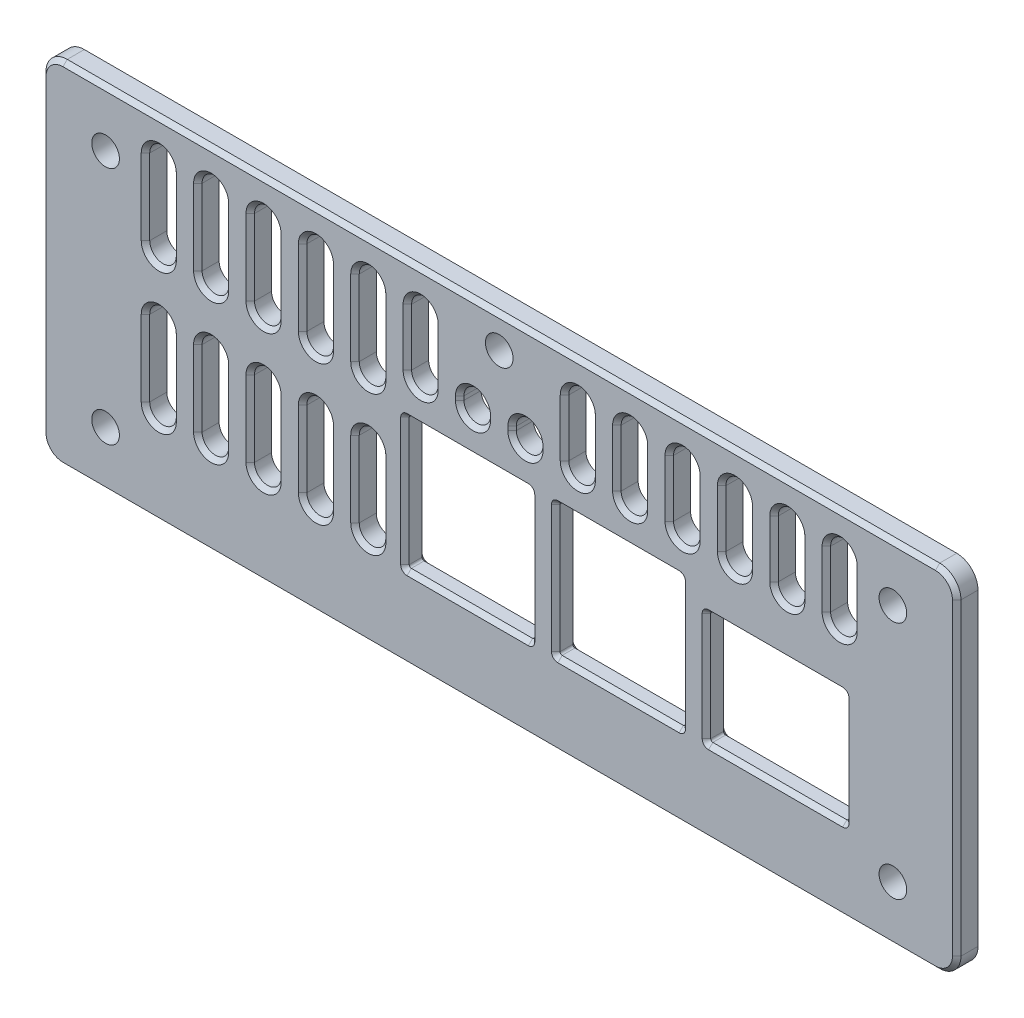
from build123d import *

# Parameters (mm, degrees)
SKETCH1_W               = 109.22
SKETCH1_H               = 41.91
BOSS_EXTRUDE1_DEPTH     = 2.54
CUT_EXTRUDE2_DEPTH      = 59.547550974
CUT_EXTRUDE2_DEPTH_BACK = 59.547550974
SKETCH4_R               = 1.651
FILLET1_R               = 2.54
SKETCH3_W               = 14.986
SKETCH3_H               = 15.748
SKETCH3_W_2             = 16.51
SKETCH3_H_2             = 13.462
RPI_4_CUTOUT_DEPTH      = 59.547550974
SKETCH14_R              = 1.651
CUT_EXTRUDE8_DEPTH      = 59.547550974
CUT_EXTRUDE9_DEPTH      = 59.547550974
CUT_EXTRUDE15_DEPTH     = 59.547550974
FILLET3_R               = 0.254
CHAMFER2_SIZE           = 0.508
CHAMFER3_SIZE           = 0.508


with BuildPart() as part:
    # Sketch1 → Boss-Extrude1 (new body)
    with BuildSketch(Plane.XY):
        Rectangle(SKETCH1_W, SKETCH1_H)
    extrude(amount=BOSS_EXTRUDE1_DEPTH)

    # Sketch4 → Cut-Extrude2 (cut, two sides: drawn at the far end of the back side and taken through both)
    with BuildSketch(Plane.XY.offset(2.54).offset(-CUT_EXTRUDE2_DEPTH_BACK)):
        with Locations((-46.99, 14.2875)):
            Circle(SKETCH4_R)
        with Locations((-46.99, -14.2875)):
            Circle(SKETCH4_R)
        with Locations((46.99, -14.2875)):
            Circle(SKETCH4_R)
        with Locations((46.99, 14.2875)):
            Circle(SKETCH4_R)
    extrude(amount=CUT_EXTRUDE2_DEPTH + CUT_EXTRUDE2_DEPTH_BACK, mode=Mode.SUBTRACT)

    # Fillet1
    fillet1_edges = [part.edges().sort_by_distance(p)[0] for p in [
        (-54.61, 20.955, 1.27),
        (54.61, 20.955, 1.27),
        (54.61, -20.955, 1.27),
        (-54.61, -20.955, 1.27),
    ]]
    fillet(fillet1_edges, radius=FILLET1_R)

    # Sketch3 → RPi 4 Cutout (cut, through all)
    with BuildSketch(Plane.XY.offset(2.54)):
        with Locations((-3.76, -3.2512)):
            Rectangle(SKETCH3_W, SKETCH3_H)
        with Locations((14.24, -3.2512)):
            Rectangle(SKETCH3_W, SKETCH3_H)
        with Locations((32.99, -4.3942)):
            Rectangle(SKETCH3_W_2, SKETCH3_H_2)
    extrude(amount=-RPI_4_CUTOUT_DEPTH, mode=Mode.SUBTRACT)

    # Sketch14 → Cut-Extrude8 (cut, through all)
    with BuildSketch(Plane.XY.offset(2.54)):
        with Locations((0, 17.145)):
            Circle(SKETCH14_R)
    extrude(amount=-CUT_EXTRUDE8_DEPTH, mode=Mode.SUBTRACT)

    # Sketch15 → Cut-Extrude9 (cut, through all)
    with BuildSketch(Plane.XY.offset(2.54)):
        with BuildLine():
            Line((39.0525, 9.3853), (39.0525, 16.1925))
            ThreePointArc((39.0525, 16.1925), (40.64, 17.78), (42.2275, 16.1925))
            Line((42.2275, 16.1925), (42.2275, 9.3853))
            ThreePointArc((42.2275, 9.3853), (40.64, 7.7978), (39.0525, 9.3853))
        make_face()
        with BuildLine():
            Line((32.800192308, 9.3853), (32.800192308, 16.1925))
            ThreePointArc((32.800192308, 16.1925), (34.387692308, 17.78), (35.975192308, 16.1925))
            Line((35.975192308, 16.1925), (35.975192308, 9.3853))
            ThreePointArc((35.975192308, 9.3853), (34.387692308, 7.7978), (32.800192308, 9.3853))
        make_face()
        with BuildLine():
            Line((26.547884615, 9.3853), (26.547884615, 16.1925))
            ThreePointArc((26.547884615, 16.1925), (28.135384615, 17.78), (29.722884615, 16.1925))
            Line((29.722884615, 16.1925), (29.722884615, 9.3853))
            ThreePointArc((29.722884615, 9.3853), (28.135384615, 7.7978), (26.547884615, 9.3853))
        make_face()
        with BuildLine():
            Line((20.295576923, 9.3853), (20.295576923, 16.1925))
            ThreePointArc((20.295576923, 16.1925), (21.883076923, 17.78), (23.470576923, 16.1925))
            Line((23.470576923, 16.1925), (23.470576923, 9.3853))
            ThreePointArc((23.470576923, 9.3853), (21.883076923, 7.7978), (20.295576923, 9.3853))
        make_face()
        with BuildLine():
            Line((14.043269231, 9.3853), (14.043269231, 16.1925))
            ThreePointArc((14.043269231, 16.1925), (15.630769231, 17.78), (17.218269231, 16.1925))
            Line((17.218269231, 16.1925), (17.218269231, 9.3853))
            ThreePointArc((17.218269231, 9.3853), (15.630769231, 7.7978), (14.043269231, 9.3853))
        make_face()
        with BuildLine():
            Line((7.790961538, 9.3853), (7.790961538, 16.1925))
            ThreePointArc((7.790961538, 16.1925), (9.378461538, 17.78), (10.965961538, 16.1925))
            Line((10.965961538, 16.1925), (10.965961538, 9.3853))
            ThreePointArc((10.965961538, 9.3853), (9.378461538, 7.7978), (7.790961538, 9.3853))
        make_face()
        with BuildLine():
            Line((-10.965961538, 9.3853), (-10.965961538, 16.1925))
            ThreePointArc((-10.965961538, 16.1925), (-9.378461538, 17.78), (-7.790961538, 16.1925))
            Line((-7.790961538, 16.1925), (-7.790961538, 9.3853))
            ThreePointArc((-7.790961538, 9.3853), (-9.378461538, 7.7978), (-10.965961538, 9.3853))
        make_face()
        with BuildLine():
            Line((-4.713653846, 9.3853), (-4.713653846, 9.849037529))
            ThreePointArc((-4.713653846, 9.849037529), (-3.126153846, 11.436537529), (-1.538653846, 9.849037529))
            Line((-1.538653846, 9.849037529), (-1.538653846, 9.3853))
            ThreePointArc((-1.538653846, 9.3853), (-3.126153846, 7.7978), (-4.713653846, 9.3853))
        make_face()
        with BuildLine():
            Line((1.538653846, 9.3853), (1.538653846, 9.849037529))
            ThreePointArc((1.538653846, 9.849037529), (3.126153846, 11.436537529), (4.713653846, 9.849037529))
            Line((4.713653846, 9.849037529), (4.713653846, 9.3853))
            ThreePointArc((4.713653846, 9.3853), (3.126153846, 7.7978), (1.538653846, 9.3853))
        make_face()
        with BuildLine():
            Line((-17.218269231, 9.3853), (-17.218269231, 16.1925))
            ThreePointArc((-17.218269231, 16.1925), (-15.630769231, 17.78), (-14.043269231, 16.1925))
            Line((-14.043269231, 16.1925), (-14.043269231, 9.3853))
            ThreePointArc((-14.043269231, 9.3853), (-15.630769231, 7.7978), (-17.218269231, 9.3853))
        make_face()
        with BuildLine():
            Line((-23.470576923, 9.3853), (-23.470576923, 16.1925))
            ThreePointArc((-23.470576923, 16.1925), (-21.883076923, 17.78), (-20.295576923, 16.1925))
            Line((-20.295576923, 16.1925), (-20.295576923, 9.3853))
            ThreePointArc((-20.295576923, 9.3853), (-21.883076923, 7.7978), (-23.470576923, 9.3853))
        make_face()
        with BuildLine():
            Line((-29.722884615, 9.3853), (-29.722884615, 16.1925))
            ThreePointArc((-29.722884615, 16.1925), (-28.135384615, 17.78), (-26.547884615, 16.1925))
            Line((-26.547884615, 16.1925), (-26.547884615, 9.3853))
            ThreePointArc((-26.547884615, 9.3853), (-28.135384615, 7.7978), (-29.722884615, 9.3853))
        make_face()
        with BuildLine():
            Line((-35.975192308, 9.3853), (-35.975192308, 16.1925))
            ThreePointArc((-35.975192308, 16.1925), (-34.387692308, 17.78), (-32.800192308, 16.1925))
            Line((-32.800192308, 16.1925), (-32.800192308, 9.3853))
            ThreePointArc((-32.800192308, 9.3853), (-34.387692308, 7.7978), (-35.975192308, 9.3853))
        make_face()
        with BuildLine():
            Line((-42.2275, 9.3853), (-42.2275, 16.1925))
            ThreePointArc((-42.2275, 16.1925), (-40.64, 17.78), (-39.0525, 16.1925))
            Line((-39.0525, 16.1925), (-39.0525, 9.3853))
            ThreePointArc((-39.0525, 9.3853), (-40.64, 7.7978), (-42.2275, 9.3853))
        make_face()
    extrude(amount=-CUT_EXTRUDE9_DEPTH, mode=Mode.SUBTRACT)

    # Sketch22 → Cut-Extrude15 (cut, through all)
    with BuildSketch(Plane.XY.offset(2.54)):
        with BuildLine():
            Line((-39.0525, 16.1925), (-39.0525, 7.1374))
            ThreePointArc((-39.0525, 7.1374), (-40.64, 5.5499), (-42.2275, 7.1374))
            Line((-42.2275, 7.1374), (-42.2275, 16.1925))
            ThreePointArc((-42.2275, 16.1925), (-40.64, 17.78), (-39.0525, 16.1925))
        make_face()
        with BuildLine():
            Line((-39.0525, -0.4826), (-39.0525, -9.5377))
            ThreePointArc((-39.0525, -9.5377), (-40.64, -11.1252), (-42.2275, -9.5377))
            Line((-42.2275, -9.5377), (-42.2275, -0.4826))
            ThreePointArc((-42.2275, -0.4826), (-40.64, 1.1049), (-39.0525, -0.4826))
        make_face()
        with BuildLine():
            Line((-32.800192308, 16.1925), (-32.800192308, 7.1374))
            ThreePointArc((-32.800192308, 7.1374), (-34.387692308, 5.5499), (-35.975192308, 7.1374))
            Line((-35.975192308, 7.1374), (-35.975192308, 16.1925))
            ThreePointArc((-35.975192308, 16.1925), (-34.387692308, 17.78), (-32.800192308, 16.1925))
        make_face()
        with BuildLine():
            Line((-32.800192308, -0.4826), (-32.800192308, -9.5377))
            ThreePointArc((-32.800192308, -9.5377), (-34.387692308, -11.1252), (-35.975192308, -9.5377))
            Line((-35.975192308, -9.5377), (-35.975192308, -0.4826))
            ThreePointArc((-35.975192308, -0.4826), (-34.387692308, 1.1049), (-32.800192308, -0.4826))
        make_face()
        with BuildLine():
            Line((-26.547884615, 16.1925), (-26.547884615, 7.1374))
            ThreePointArc((-26.547884615, 7.1374), (-28.135384615, 5.5499), (-29.722884615, 7.1374))
            Line((-29.722884615, 7.1374), (-29.722884615, 16.1925))
            ThreePointArc((-29.722884615, 16.1925), (-28.135384615, 17.78), (-26.547884615, 16.1925))
        make_face()
        with BuildLine():
            Line((-26.547884615, -0.4826), (-26.547884615, -9.5377))
            ThreePointArc((-26.547884615, -9.5377), (-28.135384615, -11.1252), (-29.722884615, -9.5377))
            Line((-29.722884615, -9.5377), (-29.722884615, -0.4826))
            ThreePointArc((-29.722884615, -0.4826), (-28.135384615, 1.1049), (-26.547884615, -0.4826))
        make_face()
        with BuildLine():
            Line((-20.295576923, 16.1925), (-20.295576923, 7.1374))
            ThreePointArc((-20.295576923, 7.1374), (-21.883076923, 5.5499), (-23.470576923, 7.1374))
            Line((-23.470576923, 7.1374), (-23.470576923, 16.1925))
            ThreePointArc((-23.470576923, 16.1925), (-21.883076923, 17.78), (-20.295576923, 16.1925))
        make_face()
        with BuildLine():
            Line((-20.295576923, -0.4826), (-20.295576923, -9.5377))
            ThreePointArc((-20.295576923, -9.5377), (-21.883076923, -11.1252), (-23.470576923, -9.5377))
            Line((-23.470576923, -9.5377), (-23.470576923, -0.4826))
            ThreePointArc((-23.470576923, -0.4826), (-21.883076923, 1.1049), (-20.295576923, -0.4826))
        make_face()
        with BuildLine():
            Line((-14.043269231, 16.1925), (-14.043269231, 7.1374))
            ThreePointArc((-14.043269231, 7.1374), (-15.630769231, 5.5499), (-17.218269231, 7.1374))
            Line((-17.218269231, 7.1374), (-17.218269231, 16.1925))
            ThreePointArc((-17.218269231, 16.1925), (-15.630769231, 17.78), (-14.043269231, 16.1925))
        make_face()
        with BuildLine():
            Line((-14.043269231, -0.4826), (-14.043269231, -9.5377))
            ThreePointArc((-14.043269231, -9.5377), (-15.630769231, -11.1252), (-17.218269231, -9.5377))
            Line((-17.218269231, -9.5377), (-17.218269231, -0.4826))
            ThreePointArc((-17.218269231, -0.4826), (-15.630769231, 1.1049), (-14.043269231, -0.4826))
        make_face()
    extrude(amount=-CUT_EXTRUDE15_DEPTH, mode=Mode.SUBTRACT)

    # Fillet3
    fillet3_edges = [part.edges().sort_by_distance(p)[0] for p in [
        (-11.253, -11.1252, 1.27),
        (-11.253, 4.6228, 1.27),
        (3.733, 4.6228, 1.27),
        (3.733, -11.1252, 1.27),
        (6.747, -11.1252, 1.27),
        (6.747, 4.6228, 1.27),
        (21.733, 4.6228, 1.27),
        (21.733, -11.1252, 1.27),
        (24.735, -11.1252, 1.27),
        (24.735, 2.3368, 1.27),
        (41.245, 2.3368, 1.27),
        (41.245, -11.1252, 1.27),
    ]]
    fillet(fillet3_edges, radius=FILLET3_R)

    # Chamfer2
    chamfer2_edges = [part.edges().sort_by_distance(p)[0] for p in [
        (-3.76, 4.6228, 0),
        (3.733, -3.2512, 0),
        (14.24, 4.6228, 0),
        (21.733, -3.2512, 0),
        (-3.76, -11.1252, 0),
        (14.24, -11.1252, 0),
        (-11.253, -3.2512, 0),
        (6.747, -3.2512, 0),
        (32.99, -11.1252, 0),
        (24.735, -4.3942, 0),
        (32.99, 2.3368, 0),
        (41.245, -4.3942, 0),
        (3.658605122, 4.548405122, 0),
        (21.658605122, 4.548405122, 0),
        (3.658605122, -11.050805122, 0),
        (21.658605122, -11.050805122, 0),
        (-11.178605122, -11.050805122, 0),
        (6.821394878, -11.050805122, 0),
        (24.809394878, -11.050805122, 0),
        (-11.178605122, 4.548405122, 0),
        (6.821394878, 4.548405122, 0),
        (24.809394878, 2.262405122, 0),
        (41.170605122, 2.262405122, 0),
        (41.170605122, -11.050805122, 0),
    ]]
    chamfer(chamfer2_edges, length=CHAMFER2_SIZE)

    # Chamfer3
    chamfer3_edges = [part.edges().sort_by_distance(p)[0] for p in [
        (40.64, 7.7978, 2.54),
        (42.2275, 12.7889, 2.54),
        (40.64, 17.78, 2.54),
        (39.0525, 12.7889, 2.54),
        (34.387692308, 7.7978, 2.54),
        (35.975192308, 12.7889, 2.54),
        (34.387692308, 17.78, 2.54),
        (32.800192308, 12.7889, 2.54),
        (28.135384615, 7.7978, 2.54),
        (29.722884615, 12.7889, 2.54),
        (28.135384615, 17.78, 2.54),
        (26.547884615, 12.7889, 2.54),
        (21.883076923, 7.7978, 2.54),
        (23.470576923, 12.7889, 2.54),
        (21.883076923, 17.78, 2.54),
        (20.295576923, 12.7889, 2.54),
        (15.630769231, 7.7978, 2.54),
        (17.218269231, 12.7889, 2.54),
        (15.630769231, 17.78, 2.54),
        (14.043269231, 12.7889, 2.54),
        (3.126153846, 7.7978, 2.54),
        (4.713653846, 9.617168764, 2.54),
        (3.126153846, 11.436537529, 2.54),
        (1.538653846, 9.617168764, 2.54),
        (-3.126153846, 7.7978, 2.54),
        (-1.538653846, 9.617168764, 2.54),
        (-3.126153846, 11.436537529, 2.54),
        (-4.713653846, 9.617168764, 2.54),
        (-9.378461538, 7.7978, 2.54),
        (-7.790961538, 12.7889, 2.54),
        (-9.378461538, 17.78, 2.54),
        (-10.965961538, 12.7889, 2.54),
        (9.378461538, 7.7978, 2.54),
        (10.965961538, 12.7889, 2.54),
        (9.378461538, 17.78, 2.54),
        (7.790961538, 12.7889, 2.54),
        (-14.043269231, 11.66495, 2.54),
        (-15.630769231, 17.78, 2.54),
        (-17.218269231, 11.66495, 2.54),
        (-20.295576923, 11.66495, 2.54),
        (-21.883076923, 17.78, 2.54),
        (-23.470576923, 11.66495, 2.54),
        (-26.547884615, 11.66495, 2.54),
        (-28.135384615, 17.78, 2.54),
        (-29.722884615, 11.66495, 2.54),
        (-32.800192308, 11.66495, 2.54),
        (-34.387692308, 17.78, 2.54),
        (-35.975192308, 11.66495, 2.54),
        (-39.0525, 11.66495, 2.54),
        (-40.64, 17.78, 2.54),
        (-42.2275, 11.66495, 2.54),
        (0, 20.955, 2.54),
        (-28.135384615, 1.1049, 2.54),
        (-29.722884615, -5.01015, 2.54),
        (-28.135384615, -11.1252, 2.54),
        (-26.547884615, -5.01015, 2.54),
        (-21.883076923, 5.5499, 2.54),
        (-21.883076923, 1.1049, 2.54),
        (-23.470576923, -5.01015, 2.54),
        (-21.883076923, -11.1252, 2.54),
        (-20.295576923, -5.01015, 2.54),
        (-15.630769231, 5.5499, 2.54),
        (-40.64, 1.1049, 2.54),
        (-42.2275, -5.01015, 2.54),
        (-40.64, -11.1252, 2.54),
        (-39.0525, -5.01015, 2.54),
        (-34.387692308, 5.5499, 2.54),
        (-34.387692308, 1.1049, 2.54),
        (-35.975192308, -5.01015, 2.54),
        (-34.387692308, -11.1252, 2.54),
        (-32.800192308, -5.01015, 2.54),
        (54.61, 0, 2.54),
        (-28.135384615, 5.5499, 2.54),
        (-15.630769231, 1.1049, 2.54),
        (-17.218269231, -5.01015, 2.54),
        (-15.630769231, -11.1252, 2.54),
        (-14.043269231, -5.01015, 2.54),
        (-54.61, 0, 2.54),
        (-40.64, 5.5499, 2.54),
        (0, -20.955, 2.54),
        (-53.866051224, 20.211051224, 2.54),
        (-53.866051224, -20.211051224, 2.54),
        (53.866051224, -20.211051224, 2.54),
        (53.866051224, 20.211051224, 2.54),
        (-3.76, 4.6228, 2.54),
        (3.733, -3.2512, 2.54),
        (14.24, 4.6228, 2.54),
        (21.733, -3.2512, 2.54),
        (-3.76, -11.1252, 2.54),
        (14.24, -11.1252, 2.54),
        (-11.253, -3.2512, 2.54),
        (6.747, -3.2512, 2.54),
        (32.99, -11.1252, 2.54),
        (24.735, -4.3942, 2.54),
        (32.99, 2.3368, 2.54),
        (41.245, -4.3942, 2.54),
        (3.658605122, 4.548405122, 2.54),
        (21.658605122, 4.548405122, 2.54),
        (3.658605122, -11.050805122, 2.54),
        (21.658605122, -11.050805122, 2.54),
        (-11.178605122, -11.050805122, 2.54),
        (6.821394878, -11.050805122, 2.54),
        (24.809394878, -11.050805122, 2.54),
        (-11.178605122, 4.548405122, 2.54),
        (6.821394878, 4.548405122, 2.54),
        (24.809394878, 2.262405122, 2.54),
        (41.170605122, 2.262405122, 2.54),
        (41.170605122, -11.050805122, 2.54),
    ]]
    chamfer(chamfer3_edges, length=CHAMFER3_SIZE)


solid = part.part
